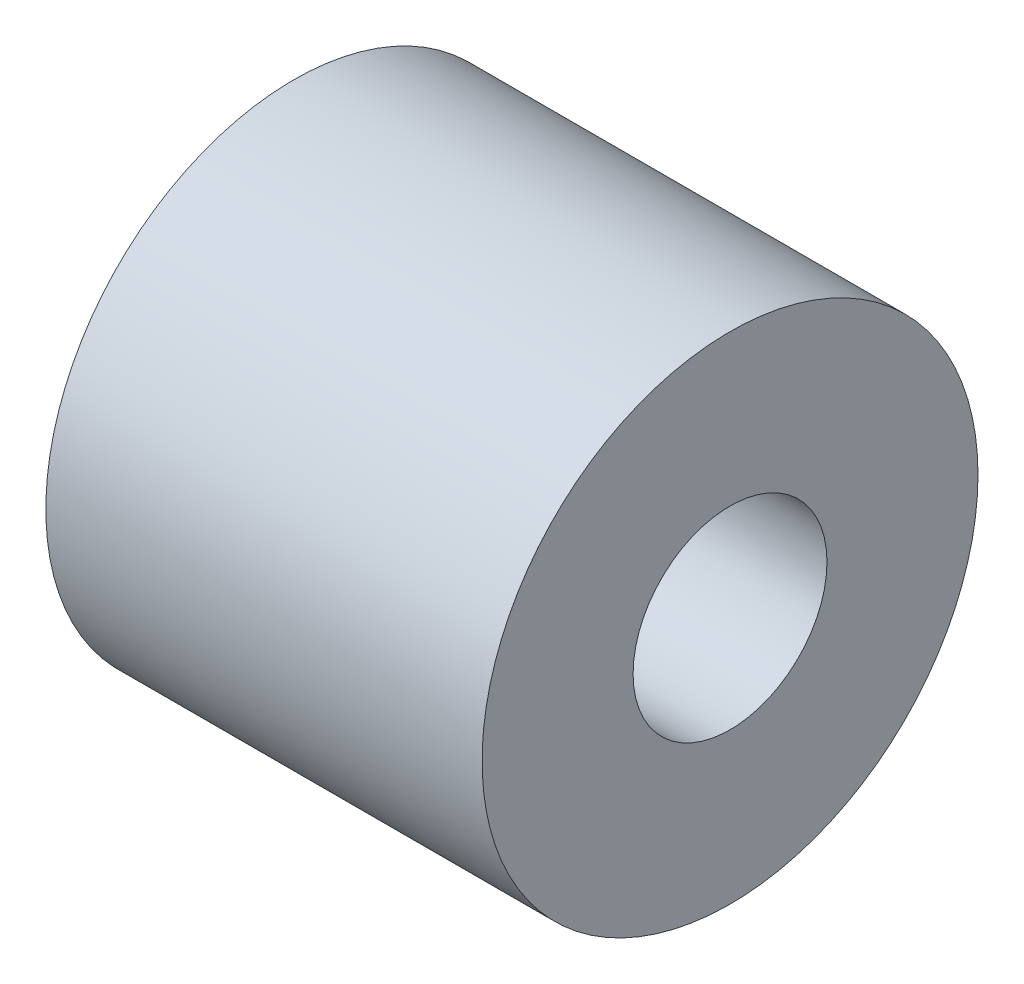
from build123d import *

# Parameters (mm, degrees)
SKETCH1_R           = 6.65
SKETCH1_R_2         = 2.6
BOSS_EXTRUDE1_DEPTH = 11.7


with BuildPart() as part:
    # Sketch1 → Boss-Extrude1 (new body)
    with BuildSketch(Plane(origin=(0, 0, 0), x_dir=(0, 0, -1), z_dir=(1, 0, 0))):
        Circle(SKETCH1_R)
        Circle(SKETCH1_R_2, mode=Mode.SUBTRACT)
    extrude(amount=BOSS_EXTRUDE1_DEPTH)


solid = part.part
